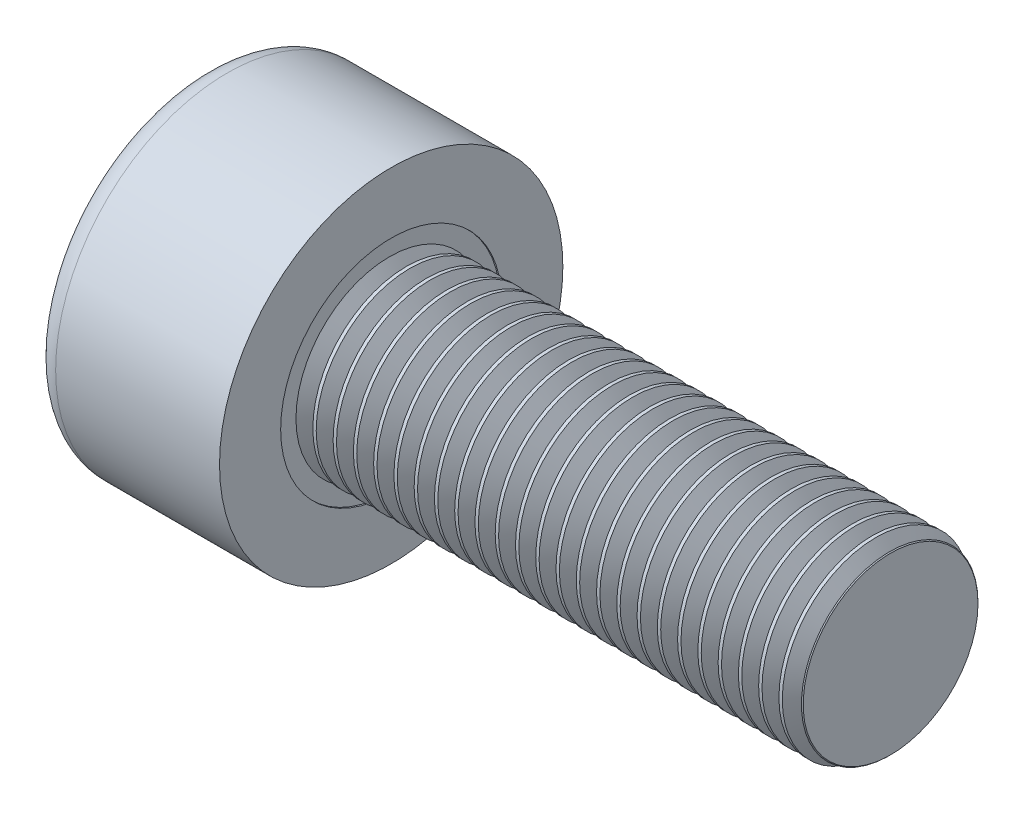
from build123d import *

# Parameters (mm, degrees)
SKETCH1_R           = 2.75
BASEHEAD_DEPTH      = 3
SKETCH2_R           = 1.5
BASEBODY_DEPTH      = 8
HEXAGONSOCKET_DEPTH = 1.3
TOPFILLET_R         = 0.375
CHAMFER1_SIZE       = 0.1
LPATTERN10_COUNT    = 25
LPATTERN10_PITCH    = 0.3246


with BuildPart() as part:
    # Sketch1 → BaseHead (new body)
    with BuildSketch(Plane(origin=(0, 0, 0), x_dir=(0, 0, -1), z_dir=(1, 0, 0))):
        Circle(SKETCH1_R)
    extrude(amount=BASEHEAD_DEPTH)

    # Sketch2 → BaseBody (add)
    with BuildSketch(Plane(origin=(3, 0, 0), x_dir=(0, 0, -1), z_dir=(1, 0, 0))):
        Circle(SKETCH2_R)
    extrude(amount=BASEBODY_DEPTH)

    # Sketch3 → HexagonSocket (cut)
    with BuildSketch(Plane(origin=(0, 0, 0), x_dir=(0, 0, -1), z_dir=(1, 0, 0))):
        Polygon((1.443375673, 0), (0.721687836, 1.25), (-0.721687836, 1.25), (-1.443375673, 0), (-0.721687836, -1.25), (0.721687836, -1.25), align=None)
    extrude(amount=HEXAGONSOCKET_DEPTH, mode=Mode.SUBTRACT)

    # Sketch4 → Cut-Revolve1 (revolve, cut)
    with BuildSketch(Plane(origin=(-4.19613823, 0.75, 0), x_dir=(-1, 0, 0), z_dir=(0, 0, 1)), mode=Mode.PRIVATE) as cut_revolve1_sk:
        Polygon((-5.49613823, 2), (-6.217826066, 0.75), (-5.49613823, 0.75), align=None)
    revolve(cut_revolve1_sk.sketch.rotate(Axis((0.838992387, 0, 0), (-1, 0, 0)), 90), axis=Axis((0.838992387, 0, 0), (-1, 0, 0)), mode=Mode.SUBTRACT)

    # TopFillet
    topfillet_edges = [part.edges().sort_by_distance(p)[0] for p in [
        (0, 0, 2.75),
    ]]
    fillet(topfillet_edges, radius=TOPFILLET_R)

    # Chamfer1
    chamfer1_edges = [part.edges().sort_by_distance(p)[0] for p in [
        (11, 0, 1.5),
    ]]
    chamfer(chamfer1_edges, length=CHAMFER1_SIZE)

    # Sketch5 → Cut-Revolve10 (revolve, cut)
    with BuildSketch(Plane.XY, mode=Mode.PRIVATE) as cut_revolve10_sk:
        Polygon((10.9, 1.265740128), (11.03525, 1.5), (11.03525, 1.7705), (10.76475, 1.7705), (10.76475, 1.5), align=None)
    cut_revolve10 = revolve(cut_revolve10_sk.sketch.rotate(Axis((0, 0, 0), (1, 0, 0)), 90), axis=Axis((0, 0, 0), (1, 0, 0)), mode=Mode.SUBTRACT)

    # LPattern10: Cut-Revolve10 ×25
    with Locations(*[(-i * LPATTERN10_PITCH, 0, 0) for i in range(1, LPATTERN10_COUNT)]):
        add(cut_revolve10, mode=Mode.SUBTRACT)


solid = part.part
